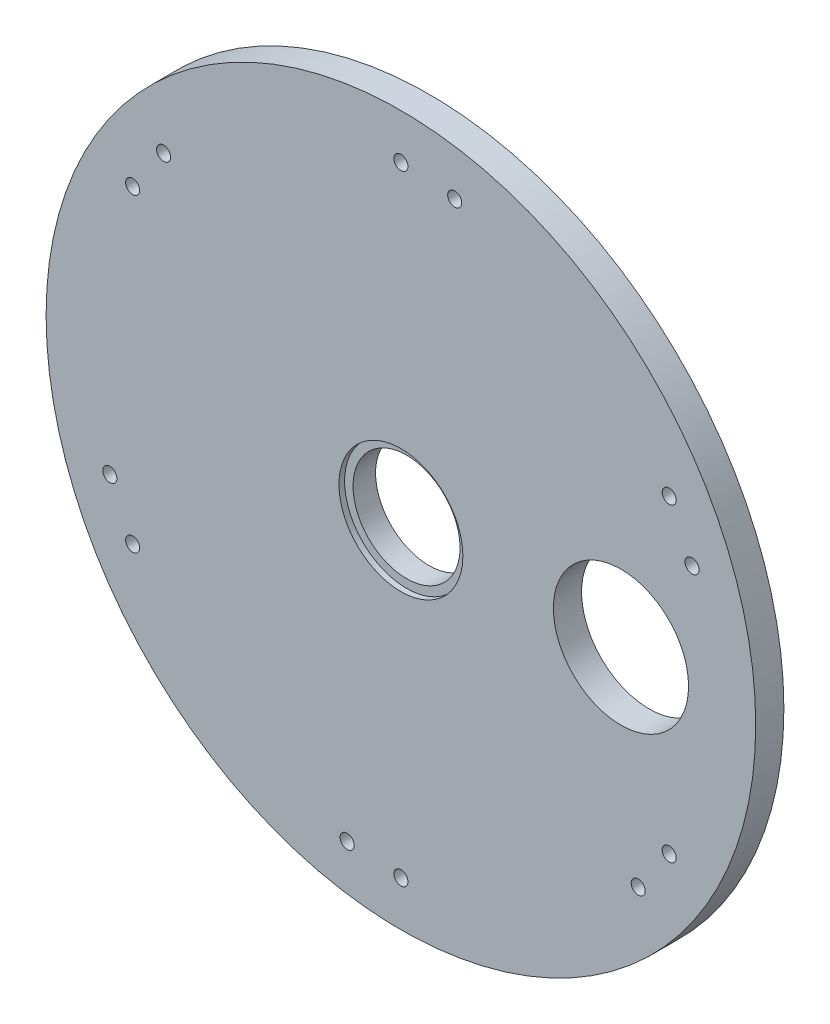
from build123d import *

# Parameters (mm, degrees)
SKETCH_1_R          = 63
SKETCH_1_R_2        = 1.25
EXTRUDE_1_DEPTH     = 5
SKETCH_2_R          = 12
CUT_EXTRUDE_4_DEPTH = 5
SKETCH_3_R          = 9.5
CUT_EXTRUDE_5_DEPTH = 10
SKETCH_4_R          = 11
CUT_EXTRUDE_6_DEPTH = 1


with BuildPart() as part:
    # 草图1 → 凸台-拉伸1 (new body)
    with BuildSketch(Plane.XY):
        Circle(SKETCH_1_R)
        with Locations((0, 55)):
            Circle(SKETCH_1_R_2, mode=Mode.SUBTRACT)
        with Locations((47.631397208, 27.5)):
            Circle(SKETCH_1_R_2, mode=Mode.SUBTRACT)
        with Locations((47.631397208, -27.5)):
            Circle(SKETCH_1_R_2, mode=Mode.SUBTRACT)
        with Locations((0, -55)):
            Circle(SKETCH_1_R_2, mode=Mode.SUBTRACT)
        with Locations((-47.631397208, -27.5)):
            Circle(SKETCH_1_R_2, mode=Mode.SUBTRACT)
        with Locations((-47.631397208, 27.5)):
            Circle(SKETCH_1_R_2, mode=Mode.SUBTRACT)
        with Locations((-42.132444372, 35.353318533)):
            Circle(SKETCH_1_R_2, mode=Mode.SUBTRACT)
        with Locations((9.550649772, 54.164426416)):
            Circle(SKETCH_1_R_2, mode=Mode.SUBTRACT)
        with Locations((51.683094143, 18.811107883)):
            Circle(SKETCH_1_R_2, mode=Mode.SUBTRACT)
        with Locations((42.132444372, -35.353318533)):
            Circle(SKETCH_1_R_2, mode=Mode.SUBTRACT)
        with Locations((-9.550649772, -54.164426416)):
            Circle(SKETCH_1_R_2, mode=Mode.SUBTRACT)
        with Locations((-51.683094143, -18.811107883)):
            Circle(SKETCH_1_R_2, mode=Mode.SUBTRACT)
    extrude(amount=EXTRUDE_1_DEPTH)

    # 草图2 → 切除-拉伸4 (cut)
    with BuildSketch(Plane.XY.offset(5)):
        with Locations((39.073033019, 0)):
            Circle(SKETCH_2_R)
    extrude(amount=-CUT_EXTRUDE_4_DEPTH, mode=Mode.SUBTRACT)

    # 草图3 → 切除-拉伸5 (cut)
    with BuildSketch(Plane.XY.offset(5)):
        Circle(SKETCH_3_R)
    extrude(amount=-CUT_EXTRUDE_5_DEPTH, mode=Mode.SUBTRACT)

    # 草图4 → 切除-拉伸6 (cut)
    with BuildSketch(Plane.XY.offset(5)):
        Circle(SKETCH_4_R)
    extrude(amount=-CUT_EXTRUDE_6_DEPTH, mode=Mode.SUBTRACT)


solid = part.part
